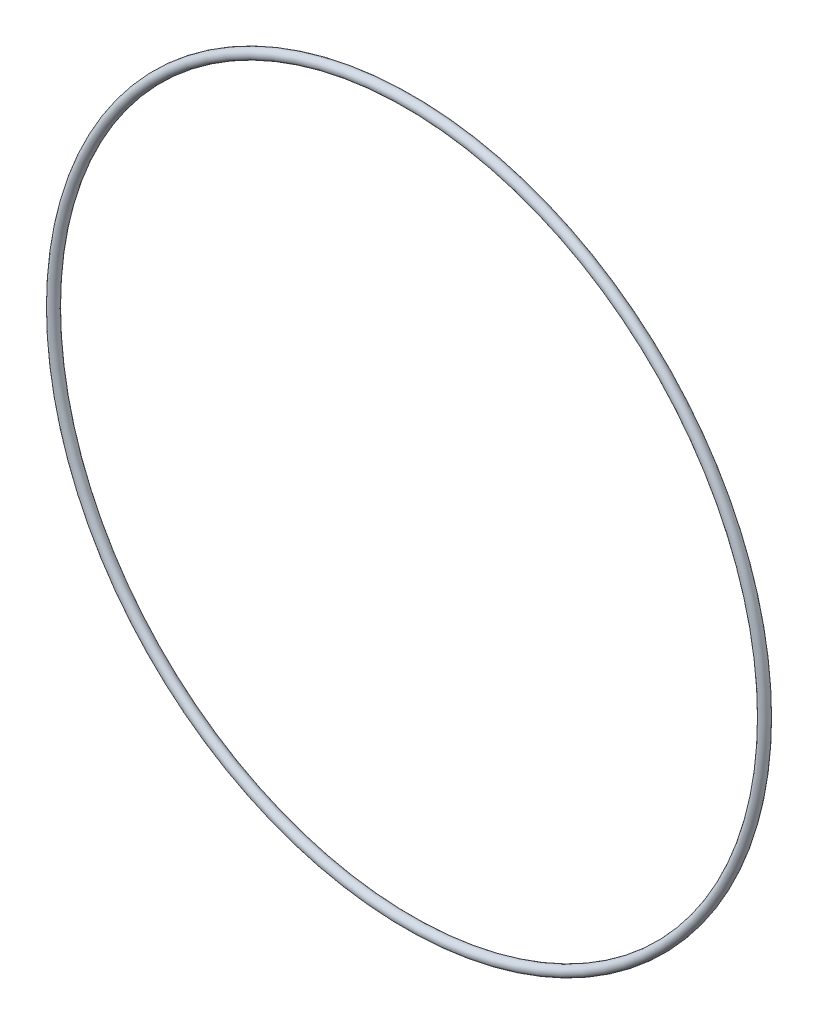
from build123d import *

# Parameters (mm, degrees)
SWEEP1_PROFILE_R = 0.8128


with BuildPart() as part:
    # Sweep1: sweep along a path in Sketch1
    with BuildLine(Plane.XY) as sweep1_path:
        CenterArc((0, 0), 58, 0, 360)
    # Sweep1 profile (on start of the path) → Sweep1 (sweep)
    with BuildSketch(Plane(origin=(58, 0, 0), x_dir=(0, 0, 1), z_dir=(0, 1, 0))):
        Circle(SWEEP1_PROFILE_R)
    sweep(path=sweep1_path.line)


solid = part.part
